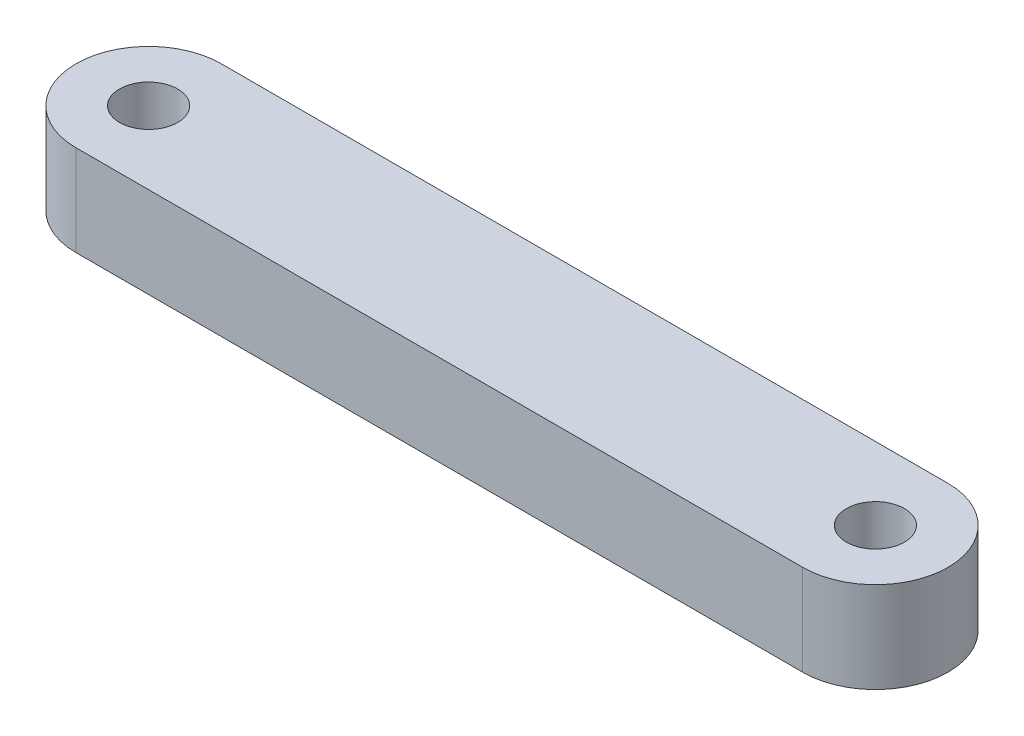
from build123d import *

# Parameters (mm, degrees)
ESQUISSE1_R        = 1.6
BOSS_EXTRU_1_DEPTH = 5


with BuildPart() as part:
    # Esquisse1 → Boss.-Extru.1 (new body)
    with BuildSketch(Plane(origin=(0, 0, 0), x_dir=(1, 0, 0), z_dir=(0, 1, 0))):
        with BuildLine():
            Line((20, -4), (-20, -4))
            ThreePointArc((-20, -4), (-24, 0), (-20, 4))
            Line((-20, 4), (20, 4))
            ThreePointArc((20, 4), (24, 0), (20, -4))
        make_face()
        with Locations(Location((-20, 0, 0), (0, 0, 270))):
            Circle(ESQUISSE1_R, mode=Mode.SUBTRACT)
        with Locations(Location((20, 0, 0), (0, 0, 270))):
            Circle(ESQUISSE1_R, mode=Mode.SUBTRACT)
    extrude(amount=BOSS_EXTRU_1_DEPTH)


solid = part.part
